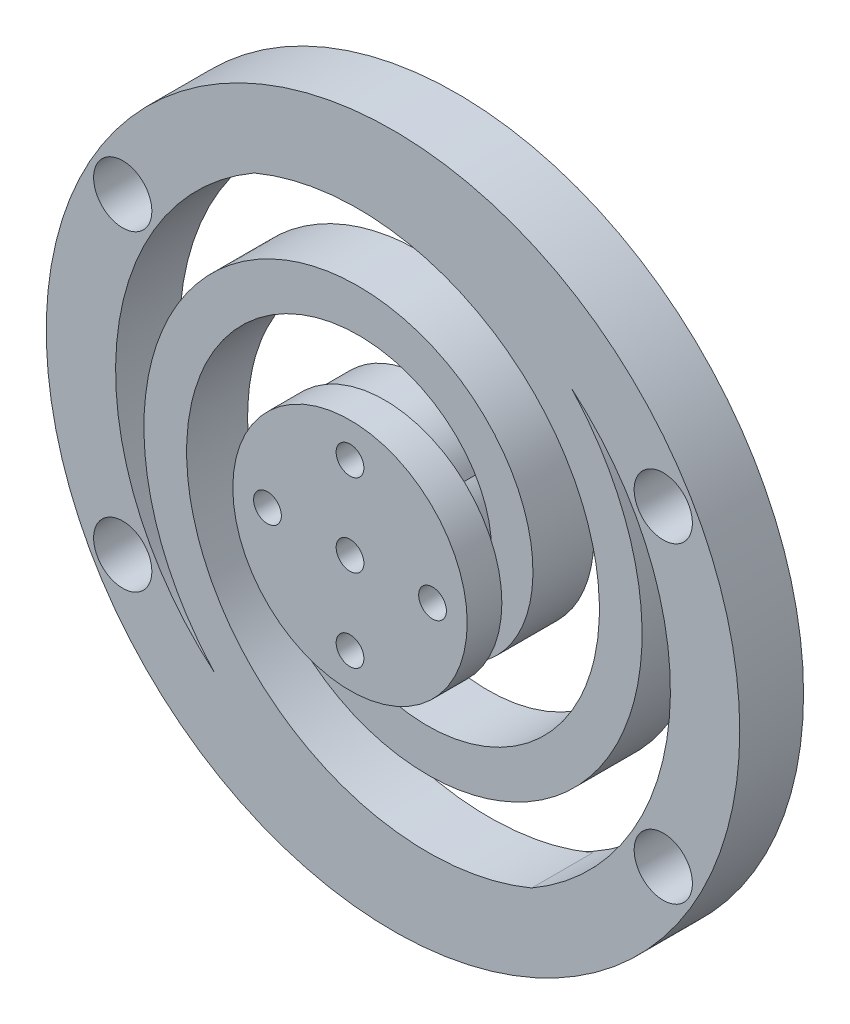
from build123d import *

# Parameters (mm, degrees)
SKETCH_2_R           = 25
SKETCH_2_R_2         = 20
EXTRUDE_2_DEPTH      = 4.6
SKETCH_23_R          = 2.1
CUT_EXTRUDE_8_DEPTH  = 3.1
SKETCH_24_R          = 1.2
CUT_EXTRUDE_9_DEPTH  = 36.490984771
EXTRUDE_START        = -4.4
EXTRUDE_3_DEPTH      = 4.4
SKETCH_19_R          = 3.975
EXTRUDE_6_DEPTH      = 3.4
SKETCH_9_R           = 3.1
CUT_EXTRUDE_1_DEPTH  = 3.1
SKETCH_10_R          = 4
EXTRUDE_4_DEPTH      = 0.6
SKETCH_11_R          = 8.45
EXTRUDE_5_DEPTH      = 2.5
SKETCH_27_R          = 1
CUT_EXTRUDE_12_DEPTH = 2.5
SKETCH_25_R          = 1
CUT_EXTRUDE_10_DEPTH = 7


with BuildPart() as part:
    # 스케치2 → 보스-돌출2 (new body)
    with BuildSketch(Plane.XY):
        Circle(SKETCH_2_R)
        Circle(SKETCH_2_R_2, mode=Mode.SUBTRACT)
    extrude(amount=EXTRUDE_2_DEPTH)

    # 스케치23 → 컷-돌출8 (cut)
    with BuildSketch(Plane.XY.offset(4.6)):
        with Locations((19.485571585, 11.25)):
            Circle(SKETCH_23_R)
        with Locations((-19.485571585, 11.25)):
            Circle(SKETCH_23_R)
        with Locations((19.485571585, -11.25)):
            Circle(SKETCH_23_R)
        with Locations((-19.485571585, -11.25)):
            Circle(SKETCH_23_R)
    extrude(amount=-CUT_EXTRUDE_8_DEPTH, mode=Mode.SUBTRACT)

    # 스케치24 → 컷-돌출9 (cut, through all)
    with BuildSketch(Plane.XY.offset(1.5)):
        with Locations((-19.485571585, 11.25)):
            Circle(SKETCH_24_R)
        with Locations((19.485571585, 11.25)):
            Circle(SKETCH_24_R)
        with Locations((19.485571585, -11.25)):
            Circle(SKETCH_24_R)
        with Locations((-19.485571585, -11.25)):
            Circle(SKETCH_24_R)
    extrude(amount=-CUT_EXTRUDE_9_DEPTH, mode=Mode.SUBTRACT)

    # 스케치8 → 보스-돌출3 (add)
    with BuildSketch(Plane.XY.offset(4.6).offset(EXTRUDE_START)):
        with BuildLine():
            ThreePointArc((-2, 3.464101615), (-3.984778792, 0.348622971), (-2.571150439, -3.064177772))
            add(Edge.make_bspline(
                [(-12.855752194, -15.320888862), (-13.751370757, -14.351807775), (-14.538879556, -13.305173027), (-15.876615285, -11.105842388), (-16.426834824, -9.953221496), (-17.279576837, -7.593225807), (-17.582107442, -6.385924575), (-17.939737171, -3.967748944), (-17.994859075, -2.756943556), (-17.868150056, -0.380663183), (-17.68635508, 0.784750173), (-17.105616757, 3.025590447), (-16.706720513, 4.100965541), (-15.719655812, 6.123031642), (-15.131543177, 7.069682554), (-13.800439762, 8.80294682), (-13.057510775, 9.589533158), (-11.455911405, 10.979670352), (-10.597305858, 11.583208006), (-8.806321779, 12.59321097), (-7.87400815, 12.999676996), (-5.978450247, 13.610648), (-5.015268055, 13.815167089), (-3.099773352, 14.026278689), (-2.147517423, 14.032897603), (-0.292843374, 13.860553944), (0.609526014, 13.681628446), (2.329879607, 13.157892686), (3.147824857, 12.813128116), (5.431876467, 11.568704847), (6.724414055, 10.457569881), (8.702488577, 7.927496754), (9.387919169, 6.510354862), (10.126319161, 3.648114629), (10.17992528, 2.204625152), (9.743968682, -0.461510297), (9.255618881, -1.68301615), (7.911286233, -3.729688241), (7.056829303, -4.554363549), (5.199881786, -5.730238206), (4.198922623, -6.081646845), (2.265557962, -6.336504819), (1.334395857, -6.240781128), (-0.288526944, -5.713555249), (-0.979557979, -5.28330189), (-2.027500016, -4.253867618), (-2.384313043, -3.656088726), (-2.571150439, -3.064177772)],
                knots=[0, 0, 0, 0, 0.03125, 0.03125, 0.0625, 0.0625, 0.09375, 0.09375, 0.125, 0.125, 0.15625, 0.15625, 0.1875, 0.1875, 0.21875, 0.21875, 0.25, 0.25, 0.28125, 0.28125, 0.3125, 0.3125, 0.34375, 0.34375, 0.375, 0.375, 0.40625, 0.40625, 0.4375, 0.4375, 0.5, 0.5, 0.5625, 0.5625, 0.625, 0.625, 0.6875, 0.6875, 0.75, 0.75, 0.8125, 0.8125, 0.875, 0.875, 0.9375, 0.9375, 1, 1, 1, 1], degree=3))
            ThreePointArc((-12.855752194, -15.320888862), (-1.743114855, -19.923893962), (10, -17.320508076))
            add(Edge.make_bspline(
                [(10, -17.320508076), (8.783042064, -17.830668978), (7.530183243, -18.212715019), (5.005955904, -18.717560031), (3.734660392, -18.84037771), (1.225334913, -18.834527023), (-0.012628707, -18.705891459), (-2.407287075, -18.214888701), (-3.563924764, -17.852566515), (-5.753560859, -16.920763231), (-6.786513646, -16.351336991), (-8.693590511, -15.039208963), (-9.567682001, -14.296569162), (-11.130206585, -12.677444408), (-11.818621094, -11.801025624), (-12.992092553, -9.957386275), (-13.477145252, -8.990233015), (-14.235667669, -7.009766985), (-14.509147156, -5.996519653), (-14.845686858, -3.968103771), (-14.908769941, -2.952995965), (-14.8345759, -0.962789801), (-14.697333267, 0.012255045), (-14.240575507, 1.884435702), (-13.921104542, 2.781527374), (-13.124818594, 4.465405889), (-12.648055117, 5.25215962), (-11.567508905, 6.689635016), (-10.963782431, 7.340335704), (-9.013215409, 9.061024323), (-7.52701619, 9.895581817), (-4.47298381, 10.889027874), (-2.906874963, 11.048430871), (0.035298734, 10.763356079), (1.410069516, 10.320026876), (3.766311386, 8.99848965), (4.747125953, 8.121811338), (6.210579769, 6.158548787), (6.693279589, 5.073566349), (7.163126871, 2.926433651), (7.15099478, 1.865650878), (6.729233279, -0.038284187), (6.320806236, -0.880550916), (5.27030368, -2.225277626), (4.629651238, -2.727479074), (3.303882164, -3.360135216), (2.620116508, -3.490977362), (2, -3.464101615)],
                knots=[0, 0, 0, 0, 0.03125, 0.03125, 0.0625, 0.0625, 0.09375, 0.09375, 0.125, 0.125, 0.15625, 0.15625, 0.1875, 0.1875, 0.21875, 0.21875, 0.25, 0.25, 0.28125, 0.28125, 0.3125, 0.3125, 0.34375, 0.34375, 0.375, 0.375, 0.40625, 0.40625, 0.4375, 0.4375, 0.5, 0.5, 0.5625, 0.5625, 0.625, 0.625, 0.6875, 0.6875, 0.75, 0.75, 0.8125, 0.8125, 0.875, 0.875, 0.9375, 0.9375, 1, 1, 1, 1], degree=3))
            ThreePointArc((2, -3.464101615), (3.984778792, -0.348622971), (2.571150439, 3.064177772))
            add(Edge.make_bspline(
                [(12.855752194, 15.320888862), (13.751370757, 14.351807775), (14.538879556, 13.305173027), (15.876615285, 11.105842388), (16.426834824, 9.953221496), (17.279576837, 7.593225807), (17.582107442, 6.385924575), (17.939737171, 3.967748944), (17.994859075, 2.756943556), (17.868150056, 0.380663183), (17.68635508, -0.784750173), (17.105616757, -3.025590447), (16.706720513, -4.100965541), (15.719655812, -6.123031642), (15.131543177, -7.069682554), (13.800439762, -8.80294682), (13.057510775, -9.589533158), (11.455911405, -10.979670352), (10.597305858, -11.583208006), (8.806321779, -12.59321097), (7.87400815, -12.999676996), (5.978450247, -13.610648), (5.015268055, -13.815167089), (3.099773352, -14.026278689), (2.147517423, -14.032897603), (0.292843374, -13.860553944), (-0.609526014, -13.681628446), (-2.329879607, -13.157892686), (-3.147824857, -12.813128116), (-5.431876467, -11.568704847), (-6.724414055, -10.457569881), (-8.702488577, -7.927496754), (-9.387919169, -6.510354862), (-10.126319161, -3.648114629), (-10.17992528, -2.204625152), (-9.743968682, 0.461510297), (-9.255618881, 1.68301615), (-7.911286233, 3.729688241), (-7.056829303, 4.554363549), (-5.199881786, 5.730238206), (-4.198922623, 6.081646845), (-2.265557962, 6.336504819), (-1.334395857, 6.240781128), (0.288526944, 5.713555249), (0.979557979, 5.28330189), (2.027500016, 4.253867618), (2.384313043, 3.656088726), (2.571150439, 3.064177772)],
                knots=[0, 0, 0, 0, 0.03125, 0.03125, 0.0625, 0.0625, 0.09375, 0.09375, 0.125, 0.125, 0.15625, 0.15625, 0.1875, 0.1875, 0.21875, 0.21875, 0.25, 0.25, 0.28125, 0.28125, 0.3125, 0.3125, 0.34375, 0.34375, 0.375, 0.375, 0.40625, 0.40625, 0.4375, 0.4375, 0.5, 0.5, 0.5625, 0.5625, 0.625, 0.625, 0.6875, 0.6875, 0.75, 0.75, 0.8125, 0.8125, 0.875, 0.875, 0.9375, 0.9375, 1, 1, 1, 1], degree=3))
            ThreePointArc((12.855752194, 15.320888862), (1.743114855, 19.923893962), (-10, 17.320508076))
            add(Edge.make_bspline(
                [(-10, 17.320508076), (-8.783042064, 17.830668978), (-7.530183243, 18.212715019), (-5.005955904, 18.717560031), (-3.734660392, 18.84037771), (-1.225334913, 18.834527023), (0.012628707, 18.705891459), (2.407287075, 18.214888701), (3.563924764, 17.852566515), (5.753560859, 16.920763231), (6.786513646, 16.351336991), (8.693590511, 15.039208963), (9.567682001, 14.296569162), (11.130206585, 12.677444408), (11.818621094, 11.801025624), (12.992092553, 9.957386275), (13.477145252, 8.990233015), (14.235667669, 7.009766985), (14.509147156, 5.996519653), (14.845686858, 3.968103771), (14.908769941, 2.952995965), (14.8345759, 0.962789801), (14.697333267, -0.012255045), (14.240575507, -1.884435702), (13.921104542, -2.781527374), (13.124818594, -4.465405889), (12.648055117, -5.25215962), (11.567508905, -6.689635016), (10.963782431, -7.340335704), (9.013215409, -9.061024323), (7.52701619, -9.895581817), (4.47298381, -10.889027874), (2.906874963, -11.048430871), (-0.035298734, -10.763356079), (-1.410069516, -10.320026876), (-3.766311386, -8.99848965), (-4.747125953, -8.121811338), (-6.210579769, -6.158548787), (-6.693279589, -5.073566349), (-7.163126871, -2.926433651), (-7.15099478, -1.865650878), (-6.729233279, 0.038284187), (-6.320806236, 0.880550916), (-5.27030368, 2.225277626), (-4.629651238, 2.727479074), (-3.303882164, 3.360135216), (-2.620116508, 3.490977362), (-2, 3.464101615)],
                knots=[0, 0, 0, 0, 0.03125, 0.03125, 0.0625, 0.0625, 0.09375, 0.09375, 0.125, 0.125, 0.15625, 0.15625, 0.1875, 0.1875, 0.21875, 0.21875, 0.25, 0.25, 0.28125, 0.28125, 0.3125, 0.3125, 0.34375, 0.34375, 0.375, 0.375, 0.40625, 0.40625, 0.4375, 0.4375, 0.5, 0.5, 0.5625, 0.5625, 0.625, 0.625, 0.6875, 0.6875, 0.75, 0.75, 0.8125, 0.8125, 0.875, 0.875, 0.9375, 0.9375, 1, 1, 1, 1], degree=3))
        make_face()
    extrude(amount=EXTRUDE_3_DEPTH)

    # 스케치19 → 보스-돌출6 (add)
    with BuildSketch(Plane(origin=(0, 0, 0.2), x_dir=(-1, 0, 0), z_dir=(0, 0, -1))):
        with Locations(Location((0, 0, 0), (0, 0, 180))):
            Circle(SKETCH_19_R)
    extrude(amount=EXTRUDE_6_DEPTH)

    # 스케치9 → 컷-돌출1 (cut)
    with BuildSketch(Plane(origin=(0, 0, -3.2), x_dir=(-1, 0, 0), z_dir=(0, 0, -1))):
        Circle(SKETCH_9_R)
    extrude(amount=-CUT_EXTRUDE_1_DEPTH, mode=Mode.SUBTRACT)

    # 스케치10 → 보스-돌출4 (add)
    with BuildSketch(Plane.XY.offset(4.6)):
        Circle(SKETCH_10_R)
    extrude(amount=EXTRUDE_4_DEPTH)

    # 스케치11 → 보스-돌출5 (add)
    with BuildSketch(Plane.XY.offset(5.2)):
        Circle(SKETCH_11_R)
    extrude(amount=EXTRUDE_5_DEPTH)

    # 스케치27 → 컷-돌출12 (cut)
    with BuildSketch(Plane.XY.offset(7.7)):
        with Locations((0, 5.95)):
            Circle(SKETCH_27_R)
        with Locations((0, -5.95)):
            Circle(SKETCH_27_R)
        with Locations((5.95, 0)):
            Circle(SKETCH_27_R)
        with Locations((-5.95, 0)):
            Circle(SKETCH_27_R)
    extrude(amount=-CUT_EXTRUDE_12_DEPTH, mode=Mode.SUBTRACT)

    # 스케치25 → 컷-돌출10 (cut)
    with BuildSketch(Plane.XY.offset(7.7)):
        Circle(SKETCH_25_R)
    extrude(amount=-CUT_EXTRUDE_10_DEPTH, mode=Mode.SUBTRACT)


solid = part.part
